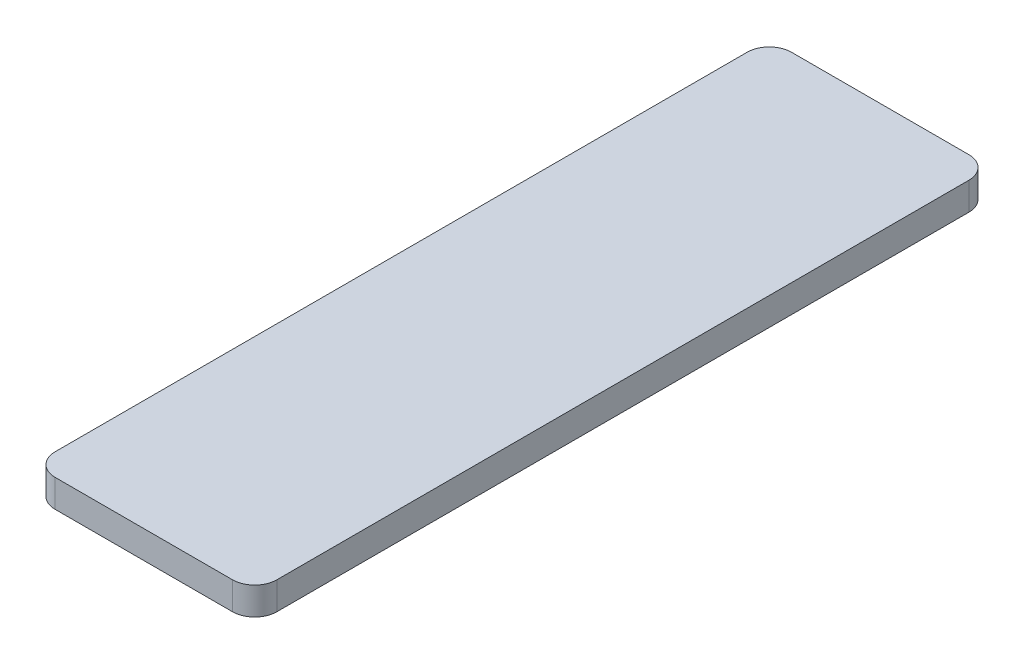
from build123d import *

# Parameters (mm, degrees)
SKETCH1_W           = 25.4
SKETCH1_H           = 84.35
BOSS_EXTRUDE1_DEPTH = 3.175
FILLET1_R           = 2.54


with BuildPart() as part:
    # Sketch1 → Boss-Extrude1 (new body)
    with BuildSketch(Plane(origin=(0, 0, 0), x_dir=(1, 0, 0), z_dir=(0, 1, 0))):
        with Locations((12.7, 42.175)):
            Rectangle(SKETCH1_W, SKETCH1_H)
    extrude(amount=BOSS_EXTRUDE1_DEPTH)

    # Fillet1
    fillet1_edges = [part.edges().sort_by_distance(p)[0] for p in [
        (0, 1.5875, -84.35),
        (25.4, 1.5875, -84.35),
        (25.4, 1.5875, 0),
        (0, 1.5875, 0),
    ]]
    fillet(fillet1_edges, radius=FILLET1_R)


solid = part.part
